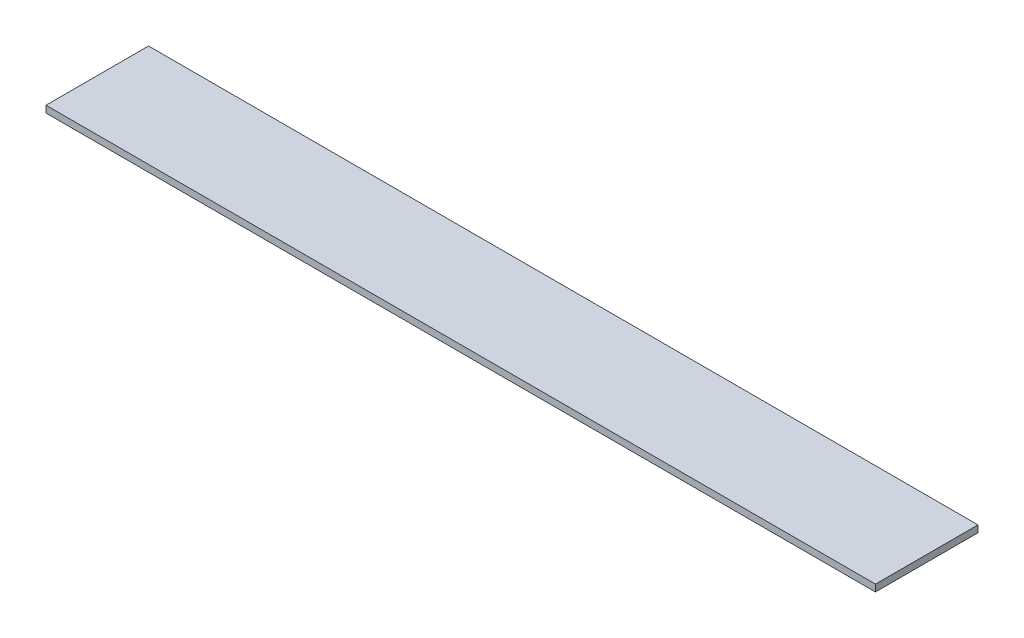
from build123d import *

# Parameters (mm, degrees)
SKETCH1_W           = 182
SKETCH1_H           = 1.5
BOSS_EXTRUDE1_DEPTH = 22.5


with BuildPart() as part:
    # Sketch1 → Boss-Extrude1 (new body)
    with BuildSketch(Plane.XY):
        Rectangle(SKETCH1_W, SKETCH1_H)
    extrude(amount=BOSS_EXTRUDE1_DEPTH)


solid = part.part
